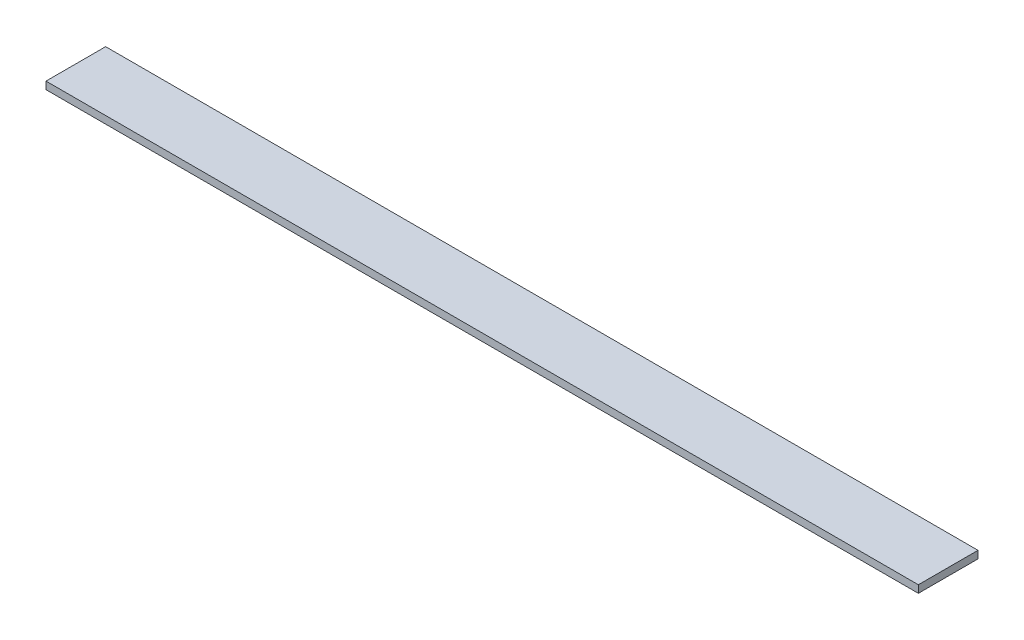
from build123d import *

# Parameters (mm, degrees)
SKETCH1_W           = 742.95
SKETCH1_H           = 50.8
BOSS_EXTRUDE1_DEPTH = 6.35


with BuildPart() as part:
    # Sketch1 → Boss-Extrude1 (new body)
    with BuildSketch(Plane(origin=(0, 0, 0), x_dir=(1, 0, 0), z_dir=(0, 1, 0))):
        Rectangle(SKETCH1_W, SKETCH1_H)
    extrude(amount=BOSS_EXTRUDE1_DEPTH)


solid = part.part
